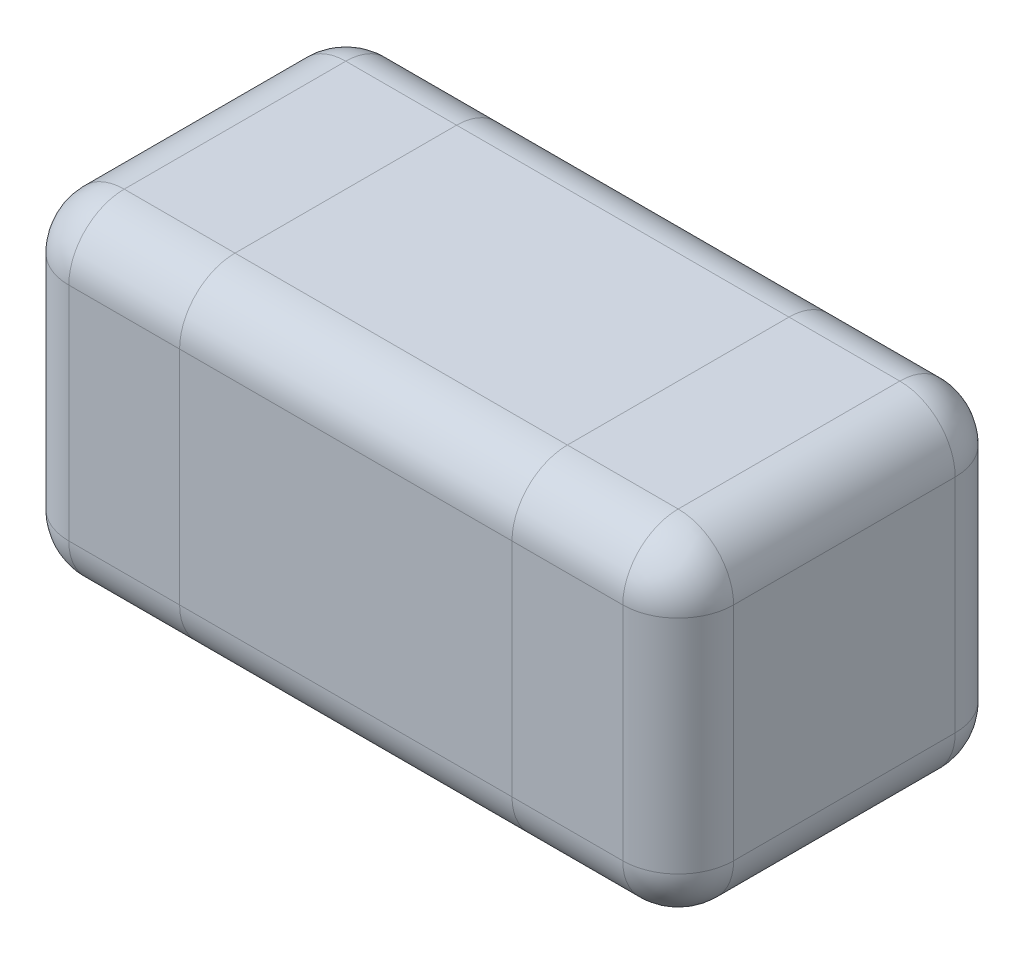
from build123d import *

# Parameters (mm, degrees)
CROQUIS1_W                = 0.3
CROQUIS1_H                = 0.3
SALIENTE_EXTRUIR1_DEPTH   = 0.3
CROQUIS3_W                = 0.15
CROQUIS3_H                = 0.3
SALIENTE_EXTRUIR3_DEPTH   = 0.3
SALIENTE_EXTRUIR3_2_DEPTH = 0.3
REDONDEO2_R               = 0.05
REDONDEO4_R               = 0.05
REDONDEO5_R               = 0.05


with BuildPart() as part:
    # Croquis1 → Saliente-Extruir1 (new body)
    with BuildSketch(Plane(origin=(0, 0, 0), x_dir=(1, 0, 0), z_dir=(0, 1, 0))):
        Rectangle(CROQUIS1_W, CROQUIS1_H)
    extrude(amount=SALIENTE_EXTRUIR1_DEPTH)

    # Redondeo2
    redondeo2_edges = [part.edges().sort_by_distance(p)[0] for p in [
        (0, 0.3, 0.15),
        (0, 0, 0.15),
        (0, 0, -0.15),
        (0, 0.3, -0.15),
    ]]
    fillet(redondeo2_edges, radius=REDONDEO2_R)


with BuildPart() as body_2:
    # Croquis3 → Saliente-Extruir3 (new body)
    with BuildSketch(Plane(origin=(0, 0, 0), x_dir=(1, 0, 0), z_dir=(0, 1, 0))):
        with Locations((0.225, 0)):
            Rectangle(CROQUIS3_W, CROQUIS3_H)
    extrude(amount=SALIENTE_EXTRUIR3_DEPTH)

    # Redondeo4
    redondeo4_edges = [body_2.edges().sort_by_distance(p)[0] for p in [
        (0.3, 0.3, 0),
        (0.225, 0.3, -0.15),
        (0.225, 0, -0.15),
        (0.3, 0, 0),
        (0.225, 0, 0.15),
        (0.3, 0.15, -0.15),
        (0.3, 0.15, 0.15),
        (0.225, 0.3, 0.15),
    ]]
    fillet(redondeo4_edges, radius=REDONDEO4_R)


with BuildPart() as body_3:
    # Croquis3 → Saliente-Extruir3 2 (new body)
    with BuildSketch(Plane(origin=(0, 0, 0), x_dir=(1, 0, 0), z_dir=(0, 1, 0))):
        with Locations((-0.225, 0)):
            Rectangle(CROQUIS3_W, CROQUIS3_H)
    extrude(amount=SALIENTE_EXTRUIR3_2_DEPTH)

    # Redondeo5
    redondeo5_edges = [body_3.edges().sort_by_distance(p)[0] for p in [
        (-0.225, 0.3, -0.15),
        (-0.3, 0.3, 0),
        (-0.225, 0.3, 0.15),
        (-0.3, 0, 0),
        (-0.225, 0, -0.15),
        (-0.225, 0, 0.15),
        (-0.3, 0.15, 0.15),
        (-0.3, 0.15, -0.15),
    ]]
    fillet(redondeo5_edges, radius=REDONDEO5_R)


solid = Compound([part.part, body_2.part, body_3.part])
